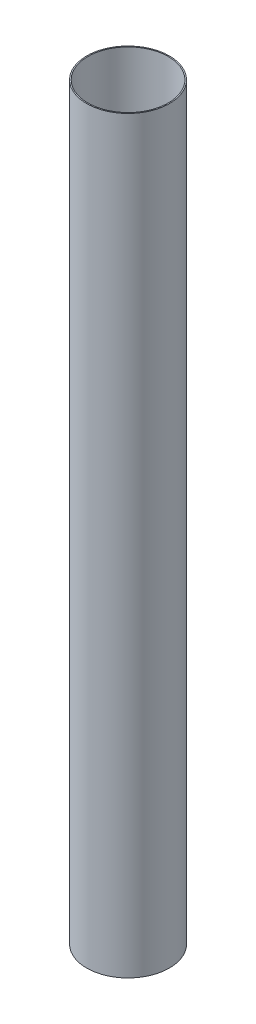
from build123d import *

# Parameters (mm, degrees)
SKETCH1_R           = 70.1675
SKETCH1_R_2         = 68.2625
BOSS_EXTRUDE1_DEPTH = 1270


with BuildPart() as part:
    # Sketch1 → Boss-Extrude1 (new body)
    with BuildSketch(Plane(origin=(0, 0, 0), x_dir=(1, 0, 0), z_dir=(0, 1, 0))):
        with Locations(Location((0, 0, 0), (0, 0, 90))):
            Circle(SKETCH1_R)
        with Locations(Location((0, 0, 0), (0, 0, 90))):
            Circle(SKETCH1_R_2, mode=Mode.SUBTRACT)
    extrude(amount=BOSS_EXTRUDE1_DEPTH)


solid = part.part
